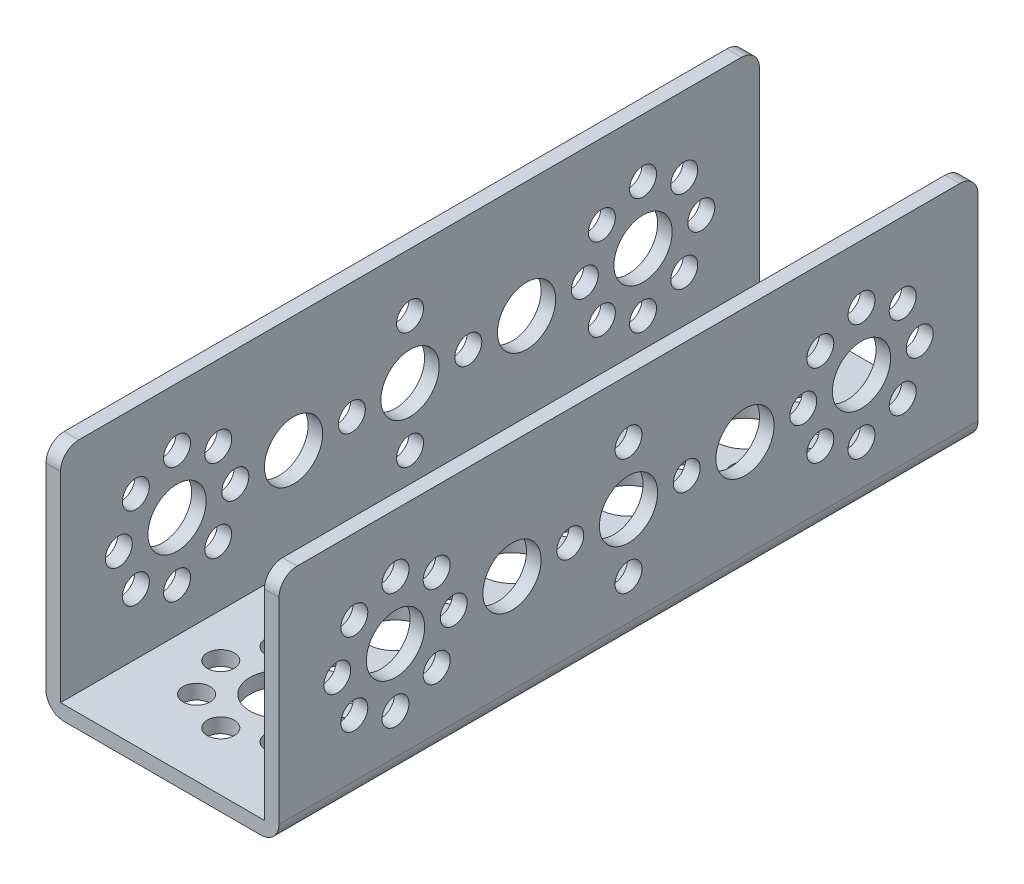
from build123d import *

# Parameters (mm, degrees)
SKETCH1_W                      = 96
SKETCH1_H                      = 32
BOSS_EXTRUDE1_DEPTH            = 32
SKETCH2_W                      = 28
SKETCH2_H                      = 30
CUT_EXTRUDE1_DEPTH             = 103.449987799
F_8_0_8_DIAMETER_HOLE1_D       = 8
F_8_0_8_DIAMETER_HOLE1_DEPTH   = 2
F_3_7_3_7_DIAMETER_HOLE1_D     = 3.7
F_3_7_3_7_DIAMETER_HOLE1_DEPTH = 2
F_3_7_3_7_DIAMETER_HOLE2_D     = 3.7
F_3_7_3_7_DIAMETER_HOLE2_DEPTH = 32
F_8_0_8_DIAMETER_HOLE2_D       = 8
F_8_0_8_DIAMETER_HOLE2_DEPTH   = 32
F_8_0_8_DIAMETER_HOLE3_D       = 8
F_8_0_8_DIAMETER_HOLE4_D       = 8
F_8_0_8_DIAMETER_HOLE4_DEPTH   = 32
F_3_7_3_7_DIAMETER_HOLE3_D     = 3.7
F_3_7_3_7_DIAMETER_HOLE3_DEPTH = 32
FILLET1_R                      = 2.5


with BuildPart() as part:
    # Sketch1 → Boss-Extrude1 (new body)
    with BuildSketch(Plane(origin=(16, 0, 0), x_dir=(0, 0, -1), z_dir=(1, 0, 0))):
        with Locations((32, 16)):
            Rectangle(SKETCH1_W, SKETCH1_H)
    extrude(amount=-BOSS_EXTRUDE1_DEPTH)

    # Sketch2 → Cut-Extrude1 (cut, through all)
    with BuildSketch(Plane(origin=(0, 0, -80), x_dir=(-1, 0, 0), z_dir=(0, 0, -1))):
        with Locations((0, 17)):
            Rectangle(SKETCH2_W, SKETCH2_H)
    extrude(amount=-CUT_EXTRUDE1_DEPTH, mode=Mode.SUBTRACT)

    # Ø8.0 (8) Diameter Hole1
    with Locations(Plane.ZY.offset(16)):
        with Locations((-64, 16), (-32, 16), (-16, 16), (-48, 16), (0, 16)):
            Hole(F_8_0_8_DIAMETER_HOLE1_D / 2, depth=F_8_0_8_DIAMETER_HOLE1_DEPTH)

    # Ø3.7 (3.7) Diameter Hole1
    with Locations(Plane.ZY.offset(16)):
        with Locations((0, 24), (0, 8), (-8, 16), (8, 16), (-5.656854249, 21.656854249), (5.656854249, 21.656854249), (5.656854249, 10.343145751), (-5.656854249, 10.343145751), (-64, 24), (-64, 8), (-72, 16), (-56, 16), (-69.656854249, 21.656854249), (-58.343145751, 21.656854249), (-58.343145751, 10.343145751), (-69.656854249, 10.343145751), (-32, 24), (-40, 16), (-32, 8), (-24, 16)):
            Hole(F_3_7_3_7_DIAMETER_HOLE1_D / 2, depth=F_3_7_3_7_DIAMETER_HOLE1_DEPTH)

    # Ø3.7 (3.7) Diameter Hole2
    with Locations(Plane(origin=(0, 0, 0), x_dir=(-1, 0, 0), z_dir=(0, -1, 0))):
        with Locations((8, 0), (5.656854249, 5.656854249), (0, 8), (-5.656854249, 5.656854249), (-8, 0), (-5.656854249, -5.656854249), (0, -8), (5.656854249, -5.656854249), (8, 64), (5.656854249, 69.656854249), (0, 72), (-5.656854249, 69.656854249), (-8, 64), (-5.656854249, 58.343145751), (0, 56), (5.656854249, 58.343145751), (8, 32), (0, 40), (-8, 32), (0, 24)):
            Hole(F_3_7_3_7_DIAMETER_HOLE2_D / 2, depth=F_3_7_3_7_DIAMETER_HOLE2_DEPTH)

    # Ø8.0 (8) Diameter Hole2
    with Locations(Plane(origin=(0, 0, 0), x_dir=(-1, 0, 0), z_dir=(0, -1, 0))):
        with Locations((0, 0), (0, 64), (0, 32), (0, 16), (0, 48)):
            Hole(F_8_0_8_DIAMETER_HOLE2_D / 2, depth=F_8_0_8_DIAMETER_HOLE2_DEPTH)

    # Ø8.0 (8) Diameter Hole3 (through all)
    with Locations(Plane.ZY.offset(-14)):
        with Locations((-32, 16)):
            Hole(F_8_0_8_DIAMETER_HOLE3_D / 2)

    # Ø8.0 (8) Diameter Hole4
    with Locations(Plane(origin=(16, 0, 0), x_dir=(0, 0, -1), z_dir=(1, 0, 0))):
        with Locations((64, 16), (16, 16), (48, 16), (0, 16)):
            Hole(F_8_0_8_DIAMETER_HOLE4_D / 2, depth=F_8_0_8_DIAMETER_HOLE4_DEPTH)

    # Ø3.7 (3.7) Diameter Hole3
    with Locations(Plane(origin=(16, 0, 0), x_dir=(0, 0, -1), z_dir=(1, 0, 0))):
        with Locations((0, 24), (0, 8), (8, 16), (-8, 16), (5.656854249, 21.656854249), (-5.656854249, 21.656854249), (-5.656854249, 10.343145751), (5.656854249, 10.343145751), (64, 24), (64, 8), (72, 16), (56, 16), (69.656854249, 21.656854249), (58.343145751, 21.656854249), (58.343145751, 10.343145751), (69.656854249, 10.343145751), (32, 24), (40, 16), (32, 8), (24, 16)):
            Hole(F_3_7_3_7_DIAMETER_HOLE3_D / 2, depth=F_3_7_3_7_DIAMETER_HOLE3_DEPTH)

    # Fillet1
    fillet1_edges = [part.edges().sort_by_distance(p)[0] for p in [
        (-16, 0, -32),
        (15, 32, 16),
        (15, 32, -80),
        (16, 0, -32),
        (-15, 32, -80),
        (-15, 32, 16),
    ]]
    fillet(fillet1_edges, radius=FILLET1_R)


solid = part.part
